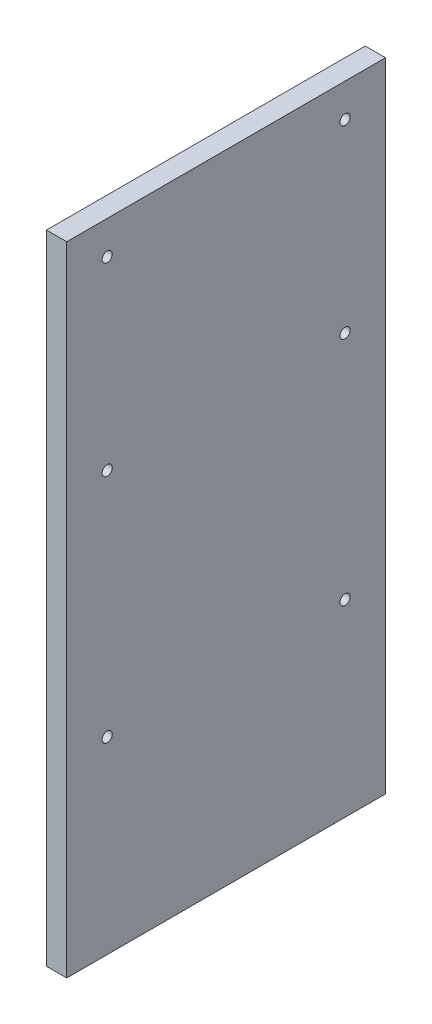
from build123d import *

# Parameters (mm, degrees)
SKETCH1_W           = 100
SKETCH1_H           = 200
BOSS_EXTRUDE1_DEPTH = 6.35
SKETCH3_R           = 1.5875
CUT_EXTRUDE1_DEPTH  = 10


with BuildPart() as part:
    # Sketch1 → Boss-Extrude1 (new body)
    with BuildSketch(Plane(origin=(0, 0, 0), x_dir=(0, 0, -1), z_dir=(1, 0, 0))):
        with Locations((50, -100)):
            Rectangle(SKETCH1_W, SKETCH1_H)
    extrude(amount=BOSS_EXTRUDE1_DEPTH)

    # Sketch3 → Cut-Extrude1 (cut)
    with BuildSketch(Plane(origin=(6.35, 0, 0), x_dir=(0, 0, -1), z_dir=(1, 0, 0))):
        with Locations((12.7, -10.44)):
            Circle(SKETCH3_R)
        with Locations((87.3, -10.44)):
            Circle(SKETCH3_R)
        with Locations((12.7, -68.44)):
            Circle(SKETCH3_R)
        with Locations((87.3, -68.44)):
            Circle(SKETCH3_R)
        with Locations((12.7, -140.84)):
            Circle(SKETCH3_R)
        with Locations((87.3, -140.84)):
            Circle(SKETCH3_R)
    extrude(amount=-CUT_EXTRUDE1_DEPTH, mode=Mode.SUBTRACT)


solid = part.part
